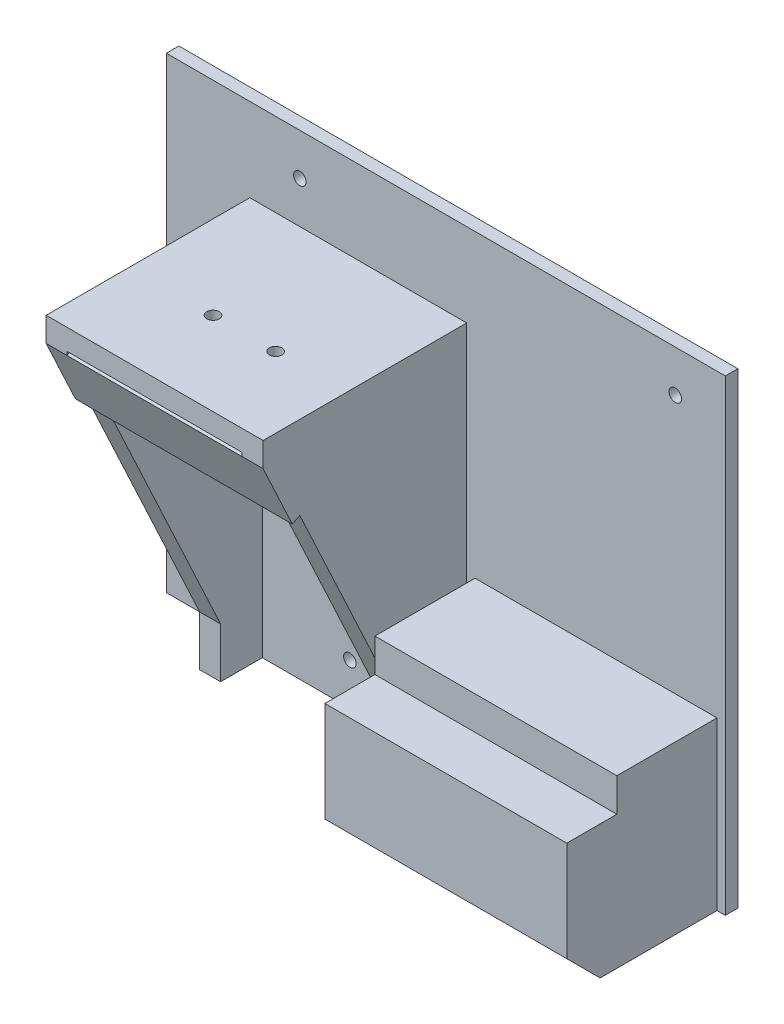
from build123d import *

# Parameters (mm, degrees)
CROQUIS1_W              = 134
CROQUIS1_H              = 112
SALIENTE_EXTRUIR1_DEPTH = 3
CROQUIS2_W              = 52
CROQUIS2_H              = 92
SALIENTE_EXTRUIR2_DEPTH = 48.812
VACIADO1_T              = -5
CORTAR_EXTRUIR1_DEPTH   = 58.812
SALIENTE_EXTRUIR3_DEPTH = 48.812
CROQUIS5_W              = 58
CROQUIS5_H              = 40
SALIENTE_EXTRUIR4_DEPTH = 36
CROQUIS6_W              = 12
CROQUIS6_H              = 7.999587761
CORTAR_EXTRUIR2_DEPTH   = 58
CROQUIS7_R              = 1.5
CORTAR_EXTRUIR3_DEPTH   = 58
CROQUIS8_R              = 1.5
CORTAR_EXTRUIR4_DEPTH   = 58


with BuildPart() as part:
    # Croquis1 → Saliente-Extruir1 (new body)
    with BuildSketch(Plane.XY):
        Rectangle(CROQUIS1_W, CROQUIS1_H)
    extrude(amount=SALIENTE_EXTRUIR1_DEPTH)

    # Croquis2 → Saliente-Extruir2 (add)
    with BuildSketch(Plane.XY.offset(3)):
        with Locations((-21, -10)):
            Rectangle(CROQUIS2_W, CROQUIS2_H)
    extrude(amount=SALIENTE_EXTRUIR2_DEPTH)

    # Vaciado1
    vaciado1_openings = [part.faces().sort_by_distance(p)[0] for p in [
        (-21, -10, 51.812),
        (-18.128790187, -56, 23.864020885),
    ]]
    offset(amount=VACIADO1_T, openings=vaciado1_openings)

    # Croquis3 → Cortar-Extruir1 (cut)
    with BuildSketch(Plane.ZY.offset(47)):
        Polygon((15, -44), (15, -56), (51.812, -56), (51.812, 30.154), (44.811949005, 15.153963498), (43.00020398, 16.000146009), align=None)
    extrude(amount=-CORTAR_EXTRUIR1_DEPTH, mode=Mode.SUBTRACT)

    # Croquis4 → Saliente-Extruir3 (add)
    with BuildSketch(Plane.ZY.offset(47)):
        Polygon((43.00020398, 16.000146009), (44.811949005, 15.153963498), (51.812, 30.154), (50.004728246, 30.997397577), align=None)
    extrude(amount=-SALIENTE_EXTRUIR3_DEPTH)

    # Croquis5 → Saliente-Extruir4 (add)
    with BuildSketch(Plane.XY.offset(3)):
        with Locations((36, -36)):
            Rectangle(CROQUIS5_W, CROQUIS5_H)
    extrude(amount=SALIENTE_EXTRUIR4_DEPTH)

    # Croquis6 → Cortar-Extruir2 (cut)
    with BuildSketch(Plane(origin=(65, 0, 0), x_dir=(0, 0, -1), z_dir=(1, 0, 0))):
        with Locations((-33, -19.999793881)):
            Rectangle(CROQUIS6_W, CROQUIS6_H)
        Polygon((-39, -56), (-31, -56), (-39, -47.999587761), align=None)
    extrude(amount=-CORTAR_EXTRUIR2_DEPTH, mode=Mode.SUBTRACT)

    # Croquis7 → Cortar-Extruir3 (cut)
    with BuildSketch(Plane.XY.offset(5)):
        with Locations((-21, -46)):
            Circle(CROQUIS7_R)
        with Locations((-35, 46)):
            Circle(CROQUIS7_R)
        with Locations((55, 46)):
            Circle(CROQUIS7_R)
    extrude(amount=-CORTAR_EXTRUIR3_DEPTH, mode=Mode.SUBTRACT)

    # Croquis8 → Cortar-Extruir4 (cut)
    with BuildSketch(Plane(origin=(0, 36, 0), x_dir=(1, 0, 0), z_dir=(0, 1, 0))):
        with Locations(Location((-27, -31.812, 0), (0, 0, 270))):
            Circle(CROQUIS8_R)
        with Locations(Location((-12, -31.812, 0), (0, 0, 270))):
            Circle(CROQUIS8_R)
    extrude(amount=-CORTAR_EXTRUIR4_DEPTH, mode=Mode.SUBTRACT)


solid = part.part
